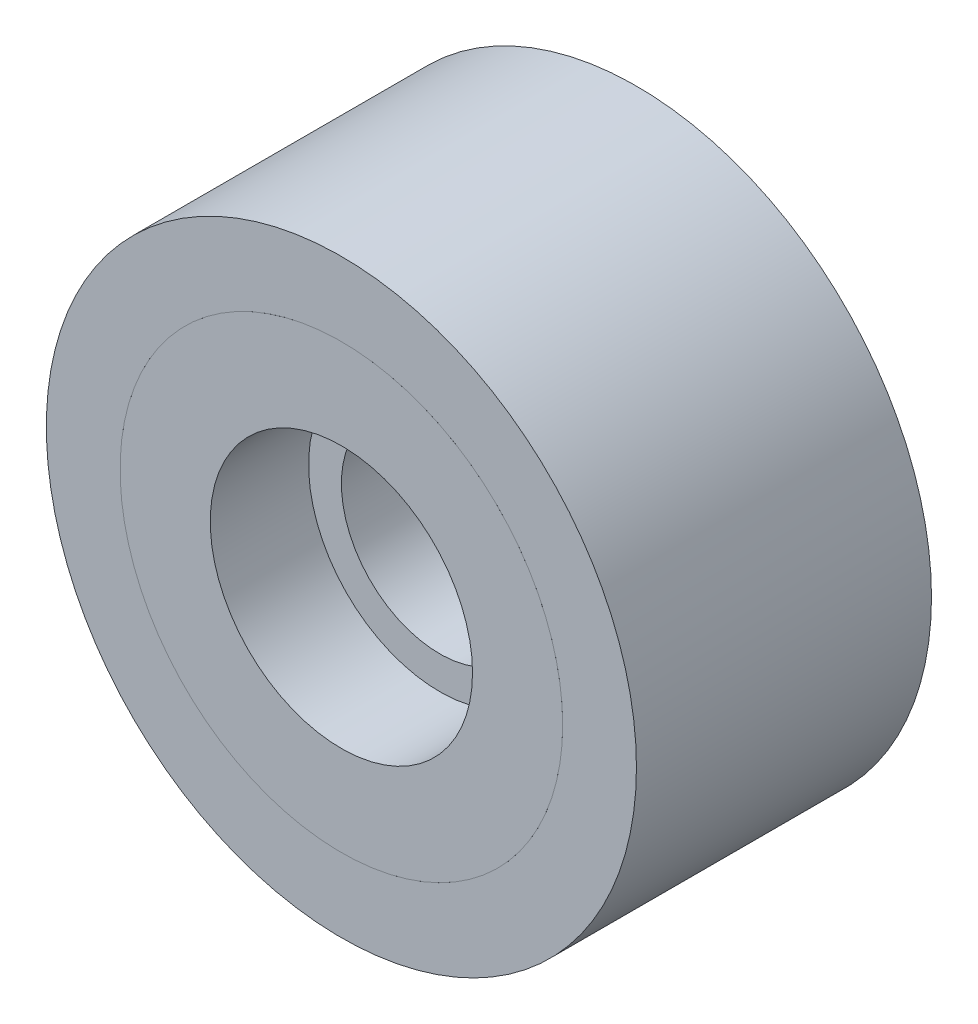
from build123d import *

# Parameters (mm, degrees)
SKETCH3_W          = 35.998
SKETCH3_H          = 8.999
SKETCH2_R          = 1.5
CUT_EXTRUDE1_DEPTH = 30


with BuildPart() as part:
    # Sketch1 → Revolve1 (revolve)
    with BuildSketch(Plane(origin=(0, 0, 0), x_dir=(0, 0, -1), z_dir=(1, 0, 0)), mode=Mode.PRIVATE) as revolve1_sk:
        Polygon((3, 27), (39, 27), (39, 16), (27, 16), (27, 12), (15, 12), (15, 16), (3, 16), align=None)
    revolve(revolve1_sk.sketch.rotate(Axis((0, 0, 0), (0, 0, -1)), 90), axis=Axis((0, 0, 0), (0, 0, -1)))

    # Sketch2 → Cut-Extrude1 (cut)
    with BuildSketch(Plane.XY.offset(-39)):
        with Locations((0, 21)):
            Circle(SKETCH2_R)
        with Locations((18.186533479, 10.5)):
            Circle(SKETCH2_R)
        with Locations((18.186533479, -10.5)):
            Circle(SKETCH2_R)
        with Locations((0, -21)):
            Circle(SKETCH2_R)
        with Locations((-18.186533479, -10.5)):
            Circle(SKETCH2_R)
        with Locations((-18.186533479, 10.5)):
            Circle(SKETCH2_R)
    extrude(amount=CUT_EXTRUDE1_DEPTH, mode=Mode.SUBTRACT)


with BuildPart() as body_2:
    # Sketch3 → Revolve2 (revolve)
    with BuildSketch(Plane(origin=(0, 0, 0), x_dir=(0, 0, -1), z_dir=(1, 0, 0)), mode=Mode.PRIVATE) as revolve2_sk:
        with Locations((21, 31.5005)):
            Rectangle(SKETCH3_W, SKETCH3_H)
    revolve(revolve2_sk.sketch.rotate(Axis((0, 0, 0), (0, 0, -1)), 90), axis=Axis((0, 0, 0), (0, 0, -1)))


solid = Compound([part.part, body_2.part])
